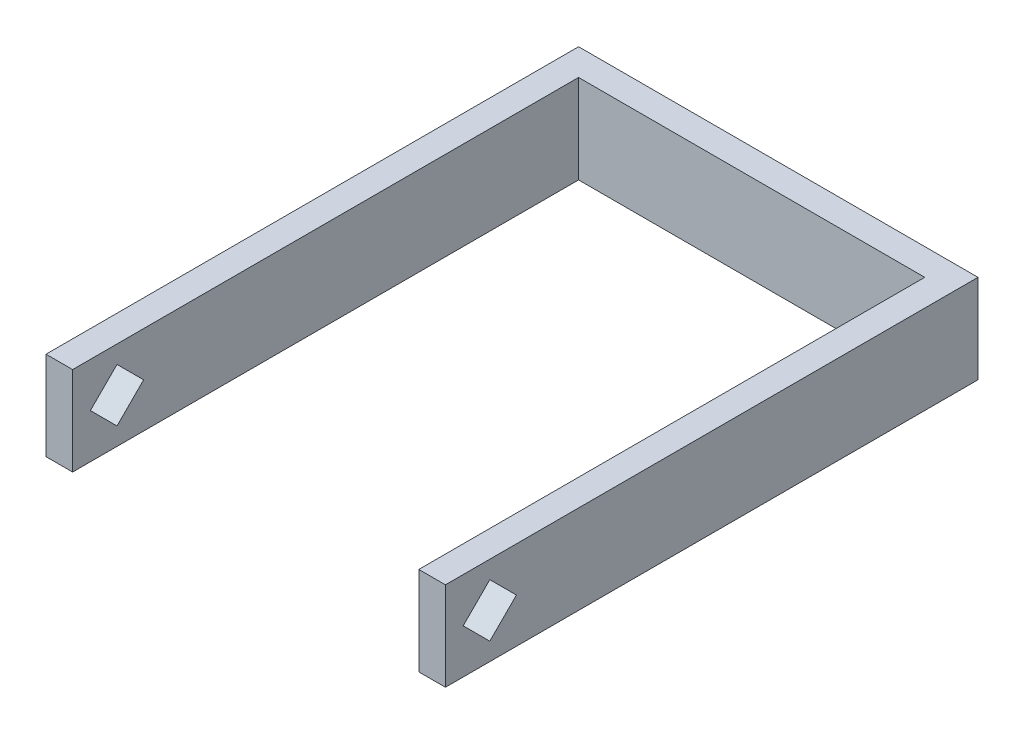
from build123d import *

# Parameters (mm, degrees)
SKETCH1_W           = 3
SKETCH1_H           = 15
BOSS_EXTRUDE1_DEPTH = 10
CUT_EXTRUDE1_DEPTH  = 60.42432162


with BuildPart() as part:
    # Sketch1 → Boss-Extrude1 (new body)
    with BuildSketch(Plane(origin=(0, 0, 0), x_dir=(1, 0, 0), z_dir=(0, 1, 0))):
        Polygon((19.5, -19.5), (19.5, 19.5), (-19.5, 19.5), (-19.5, -19.5), (-19.5, -22.5), (-22.5, -22.5), (-22.5, 22.5), (22.5, 22.5), (22.5, -22.5), (19.5, -22.5), align=None)
        with Locations((-21, -30)):
            Rectangle(SKETCH1_W, SKETCH1_H)
        with Locations((21, -30)):
            Rectangle(SKETCH1_W, SKETCH1_H)
    extrude(amount=BOSS_EXTRUDE1_DEPTH)

    # Sketch3 → Cut-Extrude1 (cut, through all)
    with BuildSketch(Plane(origin=(22.5, 0, 0), x_dir=(0, 0, -1), z_dir=(1, 0, 0))):
        Polygon((-32.5, 8), (-35.5, 5), (-32.5, 2), (-29.5, 5), align=None)
    extrude(amount=-CUT_EXTRUDE1_DEPTH, mode=Mode.SUBTRACT)


solid = part.part
